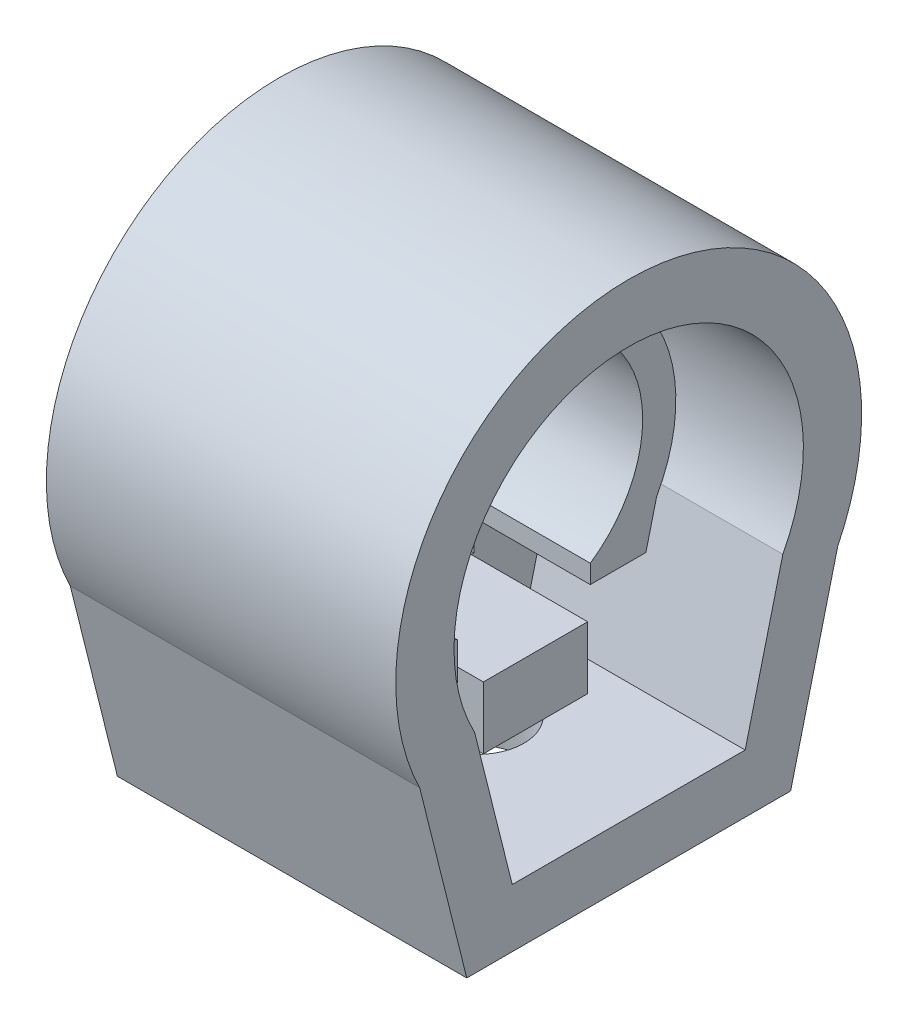
from build123d import *

# Parameters (mm, degrees)
CROQUIS1_R              = 10
SALIENTE_EXTRUIR1_DEPTH = 11
CROQUIS2_R              = 10
SALIENTE_EXTRUIR2_DEPTH = 10
CORTAR_EXTRUIR3_DEPTH   = 10
CROQUIS8_R              = 1.55
CORTAR_EXTRUIR4_DEPTH   = 5
CORTAR_EXTRUIR5_REACH   = 52.656
CORTAR_EXTRUIR6_START   = -10
CORTAR_EXTRUIR6_DEPTH   = 10
SALIENTE_EXTRUIR3_DEPTH = 30
CORTAR_EXTRUIR7_REACH   = 66.42
CROQUIS14_R             = 4


with BuildPart() as part:
    # Croquis1 → Saliente-Extruir1 (new body)
    with BuildSketch(Plane(origin=(0, 0, 0), x_dir=(0, 0, -1), z_dir=(1, 0, 0))):
        with BuildLine():
            Line((-5.780776406, 0), (-24.219223594, 0))
            Line((-24.219223594, 0), (-25, 0))
            Line((-25, 0), (-25.189366094, 0.757464375))
            Line((-25.189366094, 0.757464375), (-28.235294118, 12.941176471))
            ThreePointArc((-28.235294118, 12.941176471), (-15, 35), (-1.764705882, 12.941176471))
            Line((-1.764705882, 12.941176471), (-4.810633906, 0.757464375))
            Line((-4.810633906, 0.757464375), (-5, 0))
            Line((-5, 0), (-5.780776406, 0))
        make_face()
        with Locations((-15, 20)):
            Circle(CROQUIS1_R, mode=Mode.SUBTRACT)
    extrude(amount=SALIENTE_EXTRUIR1_DEPTH)

    # Croquis2 → Saliente-Extruir2 (add)
    with BuildSketch(Plane(origin=(11, 0, 0), x_dir=(0, 0, -1), z_dir=(1, 0, 0))):
        with BuildLine():
            Line((-23.477486008, 1.95), (-6.522513992, 1.95))
            Line((-6.522513992, 1.95), (-3.59620246, 13.655246131))
            ThreePointArc((-3.59620246, 13.655246131), (-15, 33.05), (-26.40379754, 13.655246131))
            Line((-26.40379754, 13.655246131), (-23.477486008, 1.95))
        make_face()
        with Locations((-15, 20)):
            Circle(CROQUIS2_R, mode=Mode.SUBTRACT)
    extrude(amount=SALIENTE_EXTRUIR2_DEPTH)

    # Croquis3 → Cortar-Extruir3 (cut)
    with BuildSketch(Plane(origin=(21, 0, 0), x_dir=(0, 0, -1), z_dir=(1, 0, 0))):
        Polygon((-9.522513992, 1.95), (-9.522513992, 9.95), (-4.522513992, 9.95), (-6.522513992, 1.95), align=None)
        with BuildLine():
            Line((-23.477486008, 1.95), (-18.477486008, 1.95))
            Line((-18.477486008, 1.95), (-18.477486008, 6.945227656))
            Line((-18.477486008, 6.945227656), (-18.477486008, 7.473743933))
            ThreePointArc((-18.477486008, 7.473743933), (-21.115240601, 8.528128645), (-23.461002355, 10.130276643))
            Line((-23.461002355, 10.130276643), (-23.242071918, 9.254554893))
            Line((-23.242071918, 9.254554893), (-21.915933195, 3.95))
            Line((-21.915933195, 3.95), (-23.977486008, 3.95))
            Line((-23.977486008, 3.95), (-23.477486008, 1.95))
        make_face()
    extrude(amount=-CORTAR_EXTRUIR3_DEPTH, mode=Mode.SUBTRACT)

    # Croquis8 → Cortar-Extruir4 (cut)
    with BuildSketch(Plane.XZ.offset(-1.95)):
        with Locations(Location((16, 14, 0), (0, 0, 270))):
            Circle(CROQUIS8_R)
    extrude(amount=-CORTAR_EXTRUIR4_DEPTH, mode=Mode.SUBTRACT)

    # Cortar-Extruir5: up to this face of the body (flat: up to its plane)
    cortar_extruir5_end = Plane(part.part.faces().sort_by_distance((21, 32.643992611, 15))[0])
    # Croquis11 → Cortar-Extruir5 (cut, up to the picked face)
    with BuildSketch(Plane.ZY, mode=Mode.PRIVATE) as cortar_extruir5_sk1:
        with BuildLine():
            Line((20.7, 32.7), (9.3, 32.7))
            Line((9.3, 32.7), (9.3, 28.458723308))
            ThreePointArc((9.3, 28.458723308), (4.8, 20), (9.3, 11.541276692))
            Line((9.3, 11.541276692), (9.3, 7.3))
            Line((9.3, 7.3), (20.7, 7.3))
            Line((20.7, 7.3), (20.7, 11.541276692))
            ThreePointArc((20.7, 11.541276692), (25.2, 20), (20.7, 28.458723308))
            Line((20.7, 28.458723308), (20.7, 32.7))
        make_face()
    cortar_extruir5_tool1 = split(extrude(cortar_extruir5_sk1.sketch, amount=-CORTAR_EXTRUIR5_REACH, mode=Mode.PRIVATE), bisect_by=cortar_extruir5_end, keep=Keep.BOTH, mode=Mode.PRIVATE)
    add(cortar_extruir5_tool1.solids().sort_by(Axis((0, 20, 15), (1, 0, 0)))[0], mode=Mode.SUBTRACT)

    # Croquis12 → Cortar-Extruir6 (cut)
    with BuildSketch(Plane(origin=(21, 0, 0), x_dir=(0, 0, -1), z_dir=(1, 0, 0)).offset(CORTAR_EXTRUIR6_START)):
        with BuildLine():
            Line((-18.00208261, 32.7), (-11.99791739, 32.7))
            ThreePointArc((-11.99791739, 32.7), (-15, 33.05), (-18.00208261, 32.7))
        make_face()
    extrude(amount=CORTAR_EXTRUIR6_DEPTH, mode=Mode.SUBTRACT)

    # Croquis13 → Saliente-Extruir3 (add)
    with BuildSketch(Plane.ZY):
        with BuildLine():
            Line((1.096117968, -5), (28.903882032, -5))
            Line((28.903882032, -5), (32.947577878, 11.174783385))
            ThreePointArc((32.947577878, 11.174783385), (15, 40), (-2.947577878, 11.174783385))
            Line((-2.947577878, 11.174783385), (1.096117968, -5))
        make_face()
        with BuildLine():
            Line((5, 0), (25, 0))
            Line((25, 0), (28.235294118, 12.941176471))
            ThreePointArc((28.235294118, 12.941176471), (15, 35), (1.764705882, 12.941176471))
            Line((1.764705882, 12.941176471), (5, 0))
        make_face(mode=Mode.SUBTRACT)
    extrude(amount=-SALIENTE_EXTRUIR3_DEPTH)

    # Croquis14 → Cortar-Extruir7 (cut, up to next)
    with BuildSketch(Plane.XZ.offset(5), mode=Mode.PRIVATE) as cortar_extruir7_sk1:
        with Locations(Location((16, 14, 0), (0, 0, 270))):
            Circle(CROQUIS14_R)
    cortar_extruir7_tool1 = extrude(cortar_extruir7_sk1.sketch, amount=-CORTAR_EXTRUIR7_REACH, mode=Mode.PRIVATE) & part.part
    add(cortar_extruir7_tool1.solids().sort_by_distance((16, -5, 14))[0], mode=Mode.SUBTRACT)


solid = part.part
